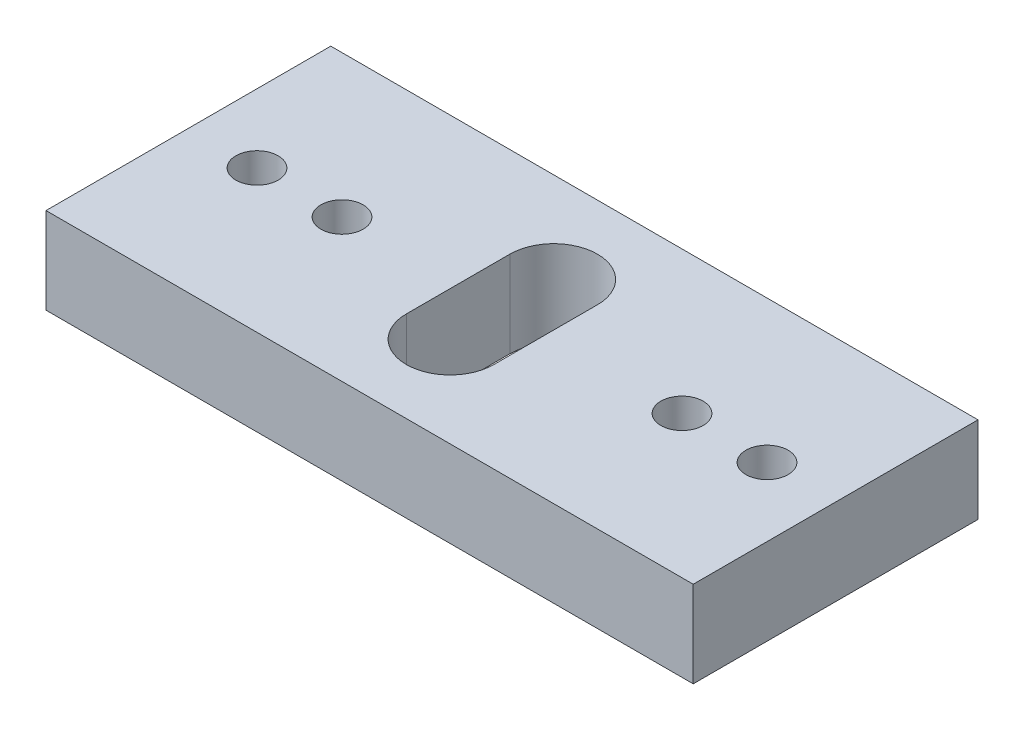
from build123d import *

# Parameters (mm, degrees)
SKETCH1_W           = 38.1
SKETCH1_H           = 16.764
SKETCH1_R           = 1.2446
BOSS_EXTRUDE1_DEPTH = 5.08


with BuildPart() as part:
    # Sketch1 → Boss-Extrude1 (new body)
    with BuildSketch(Plane(origin=(0, 0, 0), x_dir=(1, 0, 0), z_dir=(0, 1, 0))):
        Rectangle(SKETCH1_W, SKETCH1_H)
        with Locations(Location((-10.0076, 0, 0), (0, 0, 270))):
            Circle(SKETCH1_R, mode=Mode.SUBTRACT)
        with Locations(Location((-15.0114, 0, 0), (0, 0, 270))):
            Circle(SKETCH1_R, mode=Mode.SUBTRACT)
        with Locations(Location((15.0114, 0, 0), (0, 0, 90))):
            Circle(SKETCH1_R, mode=Mode.SUBTRACT)
        with Locations(Location((10.0076, 0, 0), (0, 0, 90))):
            Circle(SKETCH1_R, mode=Mode.SUBTRACT)
        with BuildLine():
            Line((1.984375, -3.048), (1.984375, 3.048))
            ThreePointArc((1.984375, 3.048), (-0.5953125, 5.6276875), (-3.175, 3.048))
            Line((-3.175, 3.048), (-3.175, -3.048))
            ThreePointArc((-3.175, -3.048), (-0.5953125, -5.6276875), (1.984375, -3.048))
        make_face(mode=Mode.SUBTRACT)
    extrude(amount=BOSS_EXTRUDE1_DEPTH)


solid = part.part
